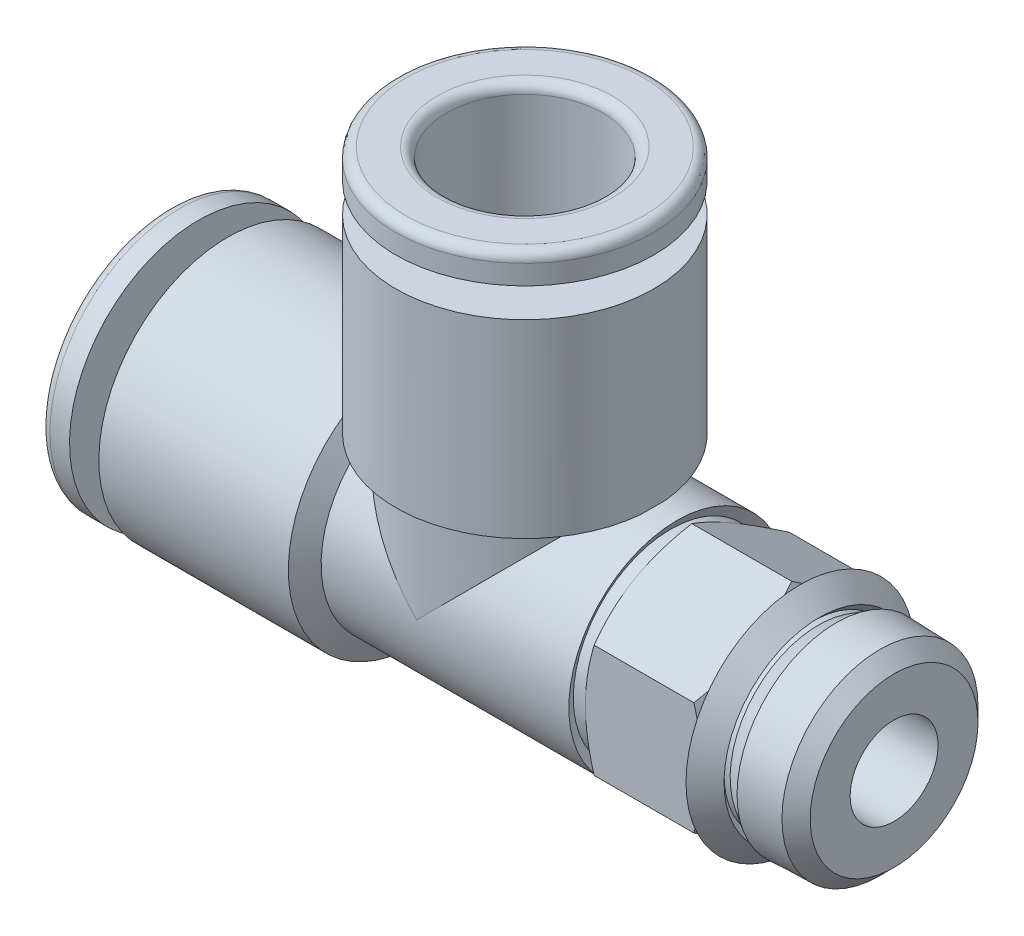
from build123d import *
from build123d.topology import SkipClean

# Parameters (mm, degrees)
SKETCH2_R            = 5.1435
EXTRUDE1_DEPTH       = 4.8
EXTRUDE1_TAPER       = 1.783333333
SKETCH5_OUTSIDE_W    = 34.108
SKETCH5_OUTSIDE_H    = 45.708
SKETCH5_OUTSIDE_R    = 4.294145567
EXTRUDE2_DEPTH       = 4.8
EXTRUDE2_DRAFT       = -45
SKETCH7_R            = 5.1435
EXTRUDE3_DEPTH       = 3
EXTRUDE3_DRAFT       = -45
EXTRUDE5_DEPTH       = 6
SKETCH9_OUTSIDE_W    = 45.292
SKETCH9_OUTSIDE_H    = 56.892
SKETCH9_OUTSIDE_R    = 5
EXTRUDE6_DEPTH       = 6
EXTRUDE6_DRAFT       = -60
SKETCH10_OUTSIDE_W   = 45.292
SKETCH10_OUTSIDE_H   = 56.892
SKETCH10_OUTSIDE_R   = 5
EXTRUDE7_DEPTH       = 6
EXTRUDE7_DRAFT       = -60
SKETCH13_R           = 4
EXTRUDE8_DEPTH       = 14.2
SKETCH14_R           = 4
EXTRUDE9_DEPTH       = 14.199
SKETCH15_R           = 2.25
EXTRUDE10_DEPTH      = 22.9
EXTRUDE11_REACH      = 42.269
EXTRUDE11_END_RADIUS = 2.25
SKETCH16_R           = 2.25


with BuildPart() as part:
    # Sketch1 → Revolve1 (revolve)
    with BuildSketch(Plane(origin=(0, 0, 0), x_dir=(-1, 0, 0), z_dir=(0, 0, -1)), mode=Mode.PRIVATE) as revolve1_sk:
        with BuildLine():
            Line((0, 6.1), (0, 4.5))
            ThreePointArc((0, 4.5), (-0.146446609, 4.146446609), (-0.5, 4))
            Line((-0.5, 4), (-14.2, 4))
            Line((-14.2, 4), (-14.2, 0))
            Line((-14.2, 0), (-18.2, 0))
            Line((-18.2, 0), (-18.2, 5.5375))
            Line((-18.2, 5.5375), (-13.312323961, 5.5375))
            Line((-13.312323961, 5.5375), (-12.6988893, 6.6))
            Line((-12.6988893, 6.6), (-3, 6.6))
            Line((-3, 6.6), (-3, 4.475))
            Line((-3, 4.475), (-1.5, 4.475))
            Line((-1.5, 4.475), (-1.5, 6.6))
            Line((-1.5, 6.6), (-0.5, 6.6))
            ThreePointArc((-0.5, 6.6), (-0.146446609, 6.453553391), (0, 6.1))
        make_face()
    revolve(revolve1_sk.sketch.rotate(Axis((0, 0, 0), (1, 0, 0)), 180), axis=Axis((0, 0, 0), (1, 0, 0)))

    # Sketch1.5 → Revolve2 (revolve)
    with BuildSketch(Plane.XY):
        with BuildLine():
            Line((22.7, 18.2), (24.3, 18.2))
            ThreePointArc((24.3, 18.2), (24.653553391, 18.053553391), (24.8, 17.7))
            Line((24.8, 17.7), (24.8, 16.7))
            Line((24.8, 16.7), (22.675, 16.7))
            Line((22.675, 16.7), (22.675, 15.2))
            Line((22.675, 15.2), (24.8, 15.2))
            Line((24.8, 15.2), (24.8, 5.5011107))
            Line((24.8, 5.5011107), (23.7375, 4.887676039))
            Line((23.7375, 4.887676039), (23.7375, 0))
            Line((23.7375, 0), (18.2, 0))
            Line((18.2, 0), (18.2, 4))
            Line((18.2, 4), (22.2, 4))
            Line((22.2, 4), (22.2, 17.7))
            ThreePointArc((22.2, 17.7), (22.346446609, 18.053553391), (22.7, 18.2))
        make_face()
    revolve(axis=Axis((18.2, 0, 0), (0, 1, 0)))



with BuildPart() as body_2:
    # Sketch2 → Extrude1 (new body)
    with BuildSketch(Plane(origin=(32.3, 0, 0), x_dir=(0, 0, -1), z_dir=(1, 0, 0))):
        Circle(SKETCH2_R)
    extrude(amount=EXTRUDE1_DEPTH, taper=EXTRUDE1_TAPER)


with BuildPart() as extrude2_tool:
    # Sketch5 outside → Extrude2 (with draft: the straight prism first)
    with BuildSketch(Plane(origin=(37.1, 0, 0), x_dir=(0, 0, -1), z_dir=(1, 0, 0))):
        with Locations((0, 5.8)):
            Rectangle(SKETCH5_OUTSIDE_W, SKETCH5_OUTSIDE_H)
        Circle(SKETCH5_OUTSIDE_R, mode=Mode.SUBTRACT)
    extrude(amount=-EXTRUDE2_DEPTH)
    # Extrude2: the draft: its side faces are tilted about the plane it starts from
    extrude2_sides = [extrude2_tool.faces().sort_by_distance(p)[0] for p in [
        (34.7, -17.054, 0),
        (34.7, 5.8, -17.054),
        (34.7, 28.654, 0),
        (34.7, 5.8, 17.054),
        (34.7, 0, 4.294145567),
    ]]
    draft(extrude2_sides, Plane(origin=(37.1, 0, 0), x_dir=(0, 0, -1), z_dir=(1, 0, 0)), EXTRUDE2_DRAFT)


with BuildPart() as body_2_1:
    add(body_2.part)

    # Extrude2: cut by extrude2_tool
    add(extrude2_tool.part, mode=Mode.SUBTRACT)

    # Sketch6 → Cut-Revolve1 (revolve, cut)
    with BuildSketch(Plane.XY):
        Polygon((32.3, -5.1435), (33.223189005, -5.114756424), (34.14637801, -5.086012849), (33.223189005, -4.514837008), (32.3, -4.543580584), align=None)
    revolve(axis=Axis((32.3, 0, 0), (1, 0, 0)), mode=Mode.SUBTRACT)


with BuildPart() as extrude3_tool:
    # Sketch7 → Extrude3 (with draft: the straight prism first)
    with BuildSketch(Plane.ZY.offset(-32.3)):
        Circle(SKETCH7_R)
    extrude(amount=-EXTRUDE3_DEPTH)
    # Extrude3: the draft: its side faces are tilted about the plane it starts from
    extrude3_sides = [extrude3_tool.faces().sort_by_distance(p)[0] for p in [
        (33.8, 0, -5.1435),
    ]]
    draft(extrude3_sides, Plane.ZY.offset(-32.3), EXTRUDE3_DRAFT)


with BuildPart() as body_2_2:
    add(body_2_1.part)

    # Extrude3: add extrude3_tool
    add(extrude3_tool.part)

    # Sketch8 → Extrude5 (add)
    with BuildSketch(Plane(origin=(32.3, 0, 0), x_dir=(0, 0, -1), z_dir=(1, 0, 0))):
        Polygon((0, 5.773502692), (-5, 2.886751346), (-5, -2.886751346), (0, -5.773502692), (5, -2.886751346), (5, 2.886751346), align=None)
    extrude(amount=-EXTRUDE5_DEPTH)


with BuildPart() as extrude6_tool:
    # Sketch9 outside → Extrude6 (with draft: the straight prism first)
    with BuildSketch(Plane(origin=(32.3, 0, 0), x_dir=(0, 0, -1), z_dir=(1, 0, 0))):
        with Locations((0, 5.8)):
            Rectangle(SKETCH9_OUTSIDE_W, SKETCH9_OUTSIDE_H)
        Circle(SKETCH9_OUTSIDE_R, mode=Mode.SUBTRACT)
    extrude(amount=-EXTRUDE6_DEPTH)
    # Extrude6: the draft: its side faces are tilted about the plane it starts from
    extrude6_sides = [extrude6_tool.faces().sort_by_distance(p)[0] for p in [
        (29.3, -22.646, 0),
        (29.3, 5.8, -22.646),
        (29.3, 34.246, 0),
        (29.3, 5.8, 22.646),
        (29.3, 0, 5),
    ]]
    draft(extrude6_sides, Plane(origin=(32.3, 0, 0), x_dir=(0, 0, -1), z_dir=(1, 0, 0)), EXTRUDE6_DRAFT)


with BuildPart() as body_2_3:
    add(body_2_2.part)

    # Extrude6: cut by extrude6_tool
    add(extrude6_tool.part, mode=Mode.SUBTRACT)


with BuildPart() as extrude7_tool:
    # Sketch10 outside → Extrude7 (with draft: the straight prism first)
    with BuildSketch(Plane.ZY.offset(-26.3)):
        with Locations((0, 5.8)):
            Rectangle(SKETCH10_OUTSIDE_W, SKETCH10_OUTSIDE_H)
        Circle(SKETCH10_OUTSIDE_R, mode=Mode.SUBTRACT)
    extrude(amount=-EXTRUDE7_DEPTH)
    # Extrude7: the draft: its side faces are tilted about the plane it starts from
    extrude7_sides = [extrude7_tool.faces().sort_by_distance(p)[0] for p in [
        (29.3, -22.646, 0),
        (29.3, 5.8, 22.646),
        (29.3, 34.246, 0),
        (29.3, 5.8, -22.646),
        (29.3, 0, -5),
    ]]
    draft(extrude7_sides, Plane.ZY.offset(-26.3), EXTRUDE7_DRAFT)


with BuildPart() as body_2_4:
    add(body_2_3.part)

    # Extrude7: cut by extrude7_tool
    add(extrude7_tool.part, mode=Mode.SUBTRACT)


with BuildPart() as body_3:
    # Sketch11 → Revolve3 (revolve)
    with BuildSketch(Plane.XY, mode=Mode.PRIVATE) as revolve3_sk:
        Polygon((32.3, 5.850606781), (33.272751601, 4.877855181), (32.91919821, 4.52430179), (32.3, 5.1435), align=None)
    revolve(revolve3_sk.sketch.rotate(Axis((0, 0, 0), (1, 0, 0)), 180), axis=Axis((0, 0, 0), (1, 0, 0)))


with BuildPart() as part_1:
    add(part.part)

    add(body_2_4.part)  # Revolve4 merges body 2
    # Sketch12 → Revolve4 (revolve)
    with BuildSketch(Plane.XY):
        Polygon((18.2, 0), (18.2, -5.5375), (25.98967423, -5.5375), (25.679348461, -5), (26.3, -5), (26.3, 0), align=None)
    revolve(axis=Axis((18.2, 0, 0), (1, 0, 0)))

    # Sketch13 → Extrude8 (cut)
    with BuildSketch(Plane.ZY.offset(-14.2)):
        with Locations(Location((0, 0, 0), (0, 0, 270))):
            Circle(SKETCH13_R)
    extrude(amount=EXTRUDE8_DEPTH, mode=Mode.SUBTRACT)

    # Sketch14 → Extrude9 (cut)
    with SkipClean():  # the faces are left unmerged after this step: merging them gives an invalid solid
        with BuildSketch(Plane(origin=(0, 18.2, 0), x_dir=(1, 0, 0), z_dir=(0, 1, 0))):
            with Locations((18.2, 0)):
                Circle(SKETCH14_R)
        extrude(amount=-EXTRUDE9_DEPTH, mode=Mode.SUBTRACT)

    # Sketch15 → Extrude10 (cut)
    with SkipClean():  # the faces are left unmerged after this step: merging them gives an invalid solid
        with BuildSketch(Plane(origin=(37.1, 0, 0), x_dir=(0, 0, -1), z_dir=(1, 0, 0))):
            with Locations(Location((0, 0, 0), (0, 0, 90))):
                Circle(SKETCH15_R)
        extrude(amount=-EXTRUDE10_DEPTH, mode=Mode.SUBTRACT)

    # Extrude11: up to this cylinder (the profile starts outside it)
    extrude11_end = Plane(origin=(18.2, 0, 0), z_dir=(1, 0, 0)) * Cylinder(EXTRUDE11_END_RADIUS, 90.038, mode=Mode.PRIVATE)
    # Sketch16 → Extrude11 (cut, up to the surface)
    with BuildSketch(Plane(origin=(0, 4.001, 0), x_dir=(1, 0, 0), z_dir=(0, 1, 0)), mode=Mode.PRIVATE) as extrude11_sk1:
        with Locations(Location((18.2, 0, 0), (0, 0, 180))):
            Circle(SKETCH16_R)
    extrude11_tool1 = extrude(extrude11_sk1.sketch, amount=-EXTRUDE11_REACH, mode=Mode.PRIVATE) - extrude11_end
    add(extrude11_tool1.solids().sort_by_distance((18.2, 4.001, 0))[0], mode=Mode.SUBTRACT)


solid = Compound([body_3.part, part_1.part])
